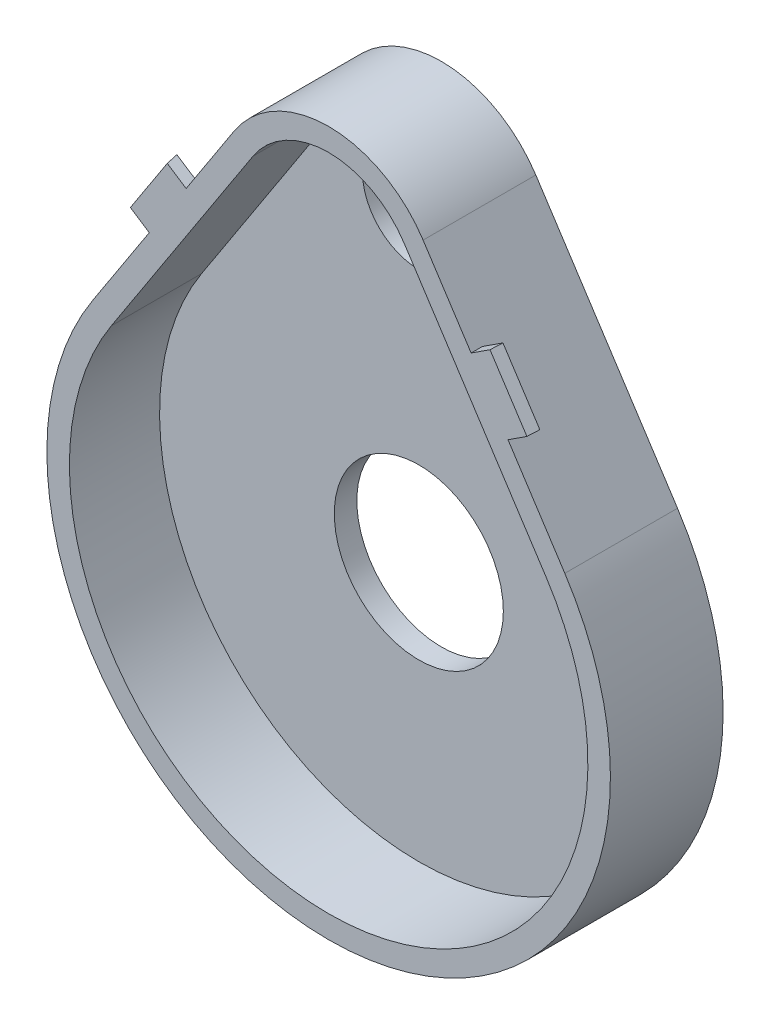
from build123d import *

# Parameters (mm, degrees)
BOSS_EXTRUDE2_DEPTH = 6.35
SHELL3_T            = -1.27
SKETCH2_7_R         = 4.7625
SKETCH2_7_R_2       = 3.175
CUT_EXTRUDE2_DEPTH  = 30.315069184
BOSS_EXTRUDE3_DEPTH = 0.635
DRAFT2_ANGLE        = 10


with BuildPart() as part:
    # Sketch2 → Boss-Extrude2 (new body)
    with BuildSketch(Plane(origin=(0, 0, 0), x_dir=(0, 1, 0), z_dir=(0, 0, 1))):
        with BuildLine():
            Line((8.659090909, -13.305478933), (20.926136364, -5.322191573))
            ThreePointArc((20.926136364, -5.322191573), (23.8125, 0), (20.926136364, 5.322191573))
            Line((20.926136364, 5.322191573), (8.659090909, 13.305478933))
            ThreePointArc((8.659090909, 13.305478933), (-15.875, 0), (8.659090909, -13.305478933))
        make_face()
    extrude(amount=BOSS_EXTRUDE2_DEPTH)

    # Shell3
    shell3_openings = [part.faces().sort_by_distance(p)[0] for p in [
        (0, 2.303090429, 6.35),
    ]]
    offset(amount=SHELL3_T, openings=shell3_openings, kind=Kind.INTERSECTION)

    # Sketch2<7> → Cut-Extrude2 (cut, through all)
    with BuildSketch(Plane(origin=(0, 0, 0), x_dir=(0, 1, 0), z_dir=(0, 0, 1))):
        with Locations(Location((0, 0, 0), (0, 0, 270))):
            Circle(SKETCH2_7_R)
        with Locations(Location((17.4625, 0, 0), (0, 0, 270))):
            Circle(SKETCH2_7_R_2)
    extrude(amount=CUT_EXTRUDE2_DEPTH, mode=Mode.SUBTRACT)

    # Sketch6 → Boss-Extrude3 (add)
    with BuildSketch(Plane(origin=(0, 0, 5.715), x_dir=(0, -1, 0), z_dir=(0, 0, 1))):
        Polygon((-16.769772727, 8.027117173), (-17.4625, 9.091555487), (-14.269185056, 11.169737305), (-13.576457783, 10.105298991), align=None)
        Polygon((-14.269185056, -11.169737305), (-13.576457783, -10.105298991), (-16.769772727, -8.027117173), (-17.4625, -9.091555487), align=None)
    extrude(amount=BOSS_EXTRUDE3_DEPTH)

    # Draft2
    draft2_faces = [part.faces().sort_by_distance(p)[0] for p in [
        (10.130646396, 15.865842528, 6.0325),
        (-10.130646396, 15.865842528, 6.0325),
    ]]
    draft(draft2_faces, Plane(origin=(0, 17.4625, 6.35), x_dir=(1, 0, 0), z_dir=(0, 0, 1)), DRAFT2_ANGLE)


solid = part.part
